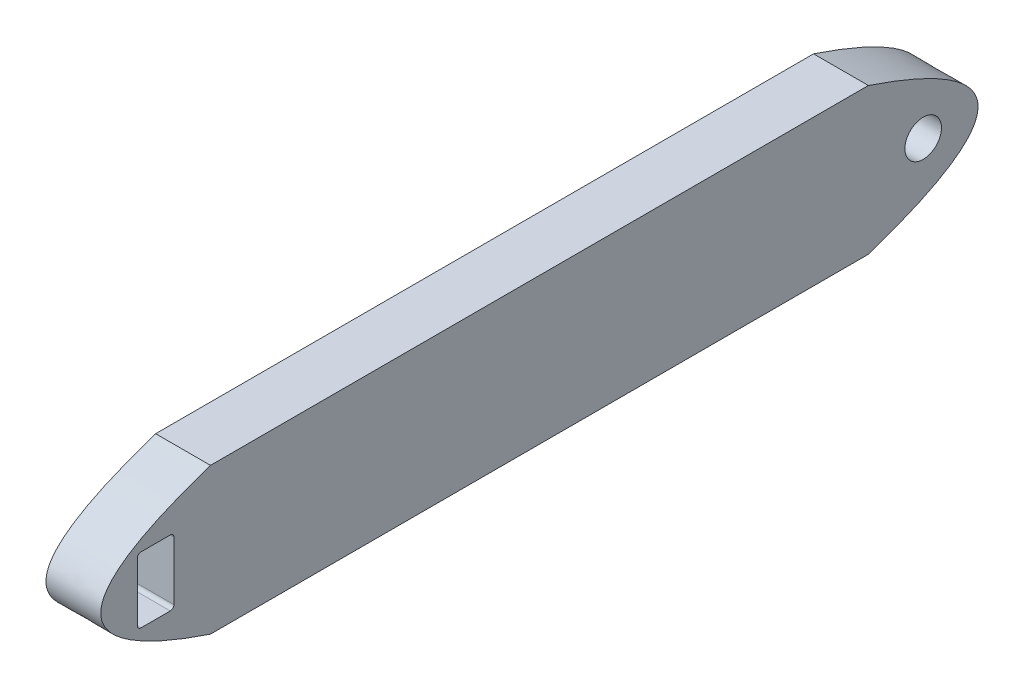
from build123d import *

# Parameters (mm, degrees)
SKETCH1_R           = 5
BOSS_EXTRUDE1_DEPTH = 15
CUT_EXTRUDE1_DEPTH  = 15


with BuildPart() as part:
    # Sketch1 → Boss-Extrude1 (new body)
    with BuildSketch(Plane(origin=(0, 0, 0), x_dir=(0, 0, -1), z_dir=(1, 0, 0))):
        with BuildLine():
            Line((-42.152698982, 21.985337207), (137.847301018, 21.985337207))
            add(Edge.make_bspline(
                [(137.847301018, 21.985337207), (197.847301018, 1.985337207), (137.847301018, -18.014662793)],
                knots=[0, 0, 0, 1, 1, 1], degree=2))
            Line((137.847301018, -18.014662793), (-42.152698982, -18.014662793))
            add(Edge.make_bspline(
                [(-42.152698982, 21.985337207), (-102.152698982, 1.985337207), (-42.152698982, -18.014662793)],
                knots=[0, 0, 0, 1, 1, 1], degree=2))
        make_face()
        with Locations((-57.152698982, 1.985337207)):
            Circle(SKETCH1_R, mode=Mode.SUBTRACT)
        with Locations((152.847301018, 1.985337207)):
            Circle(SKETCH1_R, mode=Mode.SUBTRACT)
    extrude(amount=BOSS_EXTRUDE1_DEPTH)

    # Sketch3 → Cut-Extrude1 (cut)
    with BuildSketch(Plane(origin=(15, 0, 0), x_dir=(0, 0, -1), z_dir=(1, 0, 0))):
        with BuildLine():
            Line((-53.152698982, 10.985337207), (-61.152698982, 10.985337207))
            ThreePointArc((-61.152698982, 10.985337207), (-61.859805763, 10.692443988), (-62.152698982, 9.985337207))
            Line((-62.152698982, 9.985337207), (-62.152698982, -6.014662793))
            ThreePointArc((-62.152698982, -6.014662793), (-61.859805763, -6.721769574), (-61.152698982, -7.014662793))
            Line((-61.152698982, -7.014662793), (-53.152698982, -7.014662793))
            ThreePointArc((-53.152698982, -7.014662793), (-52.4455922, -6.721769574), (-52.152698982, -6.014662793))
            Line((-52.152698982, -6.014662793), (-52.152698982, 9.985337207))
            ThreePointArc((-52.152698982, 9.985337207), (-52.4455922, 10.692443988), (-53.152698982, 10.985337207))
        make_face()
    extrude(amount=-CUT_EXTRUDE1_DEPTH, mode=Mode.SUBTRACT)


solid = part.part
